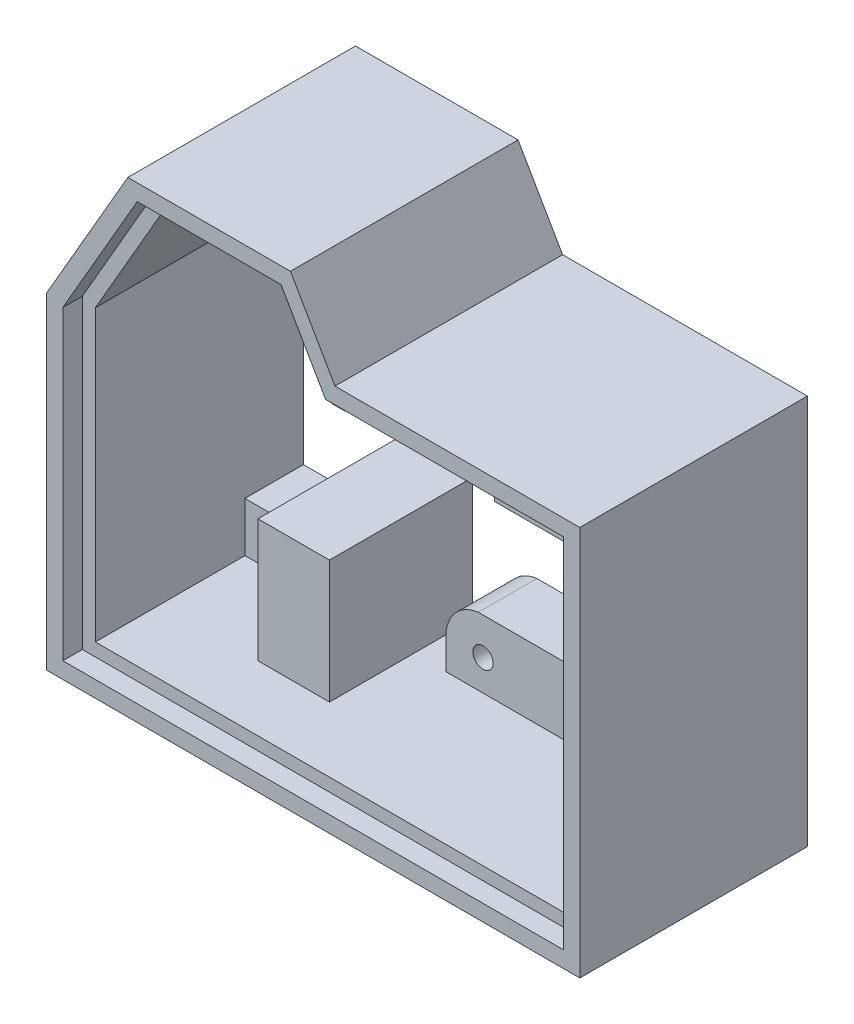
from build123d import *

# Parameters (mm, degrees)
BOSS_EXTRUDE1_DEPTH = 35
CUT_EXTRUDE1_DEPTH  = 26
SKETCH4_W           = 36.590571665
SKETCH4_H           = 16.65
BOSS_EXTRUDE2_DEPTH = 4.3
SKETCH5_W           = 22.6
SKETCH5_H           = 11.85
CUT_EXTRUDE2_DEPTH  = 4.2
CUT_EXTRUDE3_DEPTH  = 17.2
BOSS_EXTRUDE3_DEPTH = 23
SKETCH11_R          = 1.5625
CUT_EXTRUDE7_DEPTH  = 12.54
SKETCH13_R          = 1.7526
CUT_EXTRUDE8_DEPTH  = 16
SKETCH15_W          = 11
SKETCH15_H          = 18.91
BOSS_EXTRUDE4_DEPTH = 22


with BuildPart() as part:
    # Sketch1 → Boss-Extrude1 (new body)
    with BuildSketch(Plane.XY):
        Polygon((0, 50.21875), (0, 0), (82, 0), (82, 60), (44.352804008, 60), (37.500008496, 71.86939), (12.500002832, 71.86939), align=None)
    extrude(amount=BOSS_EXTRUDE1_DEPTH)

    # Sketch3 → Cut-Extrude1 (cut)
    with BuildSketch(Plane.XY.offset(35)):
        Polygon((42.909428335, 57.5), (36.056632823, 69.36939), (13.943378505, 69.36939), (2.5, 49.548877019), (2.5, 2.5), (79.5, 2.5), (79.5, 57.5), align=None)
    extrude(amount=-CUT_EXTRUDE1_DEPTH, mode=Mode.SUBTRACT)

    # Sketch4 → Boss-Extrude2 (add)
    with BuildSketch(Plane.XY.offset(9)):
        with Locations((61.204714168, 49.175)):
            Rectangle(SKETCH4_W, SKETCH4_H)
    extrude(amount=BOSS_EXTRUDE2_DEPTH)

    # Sketch5 → Cut-Extrude2 (cut)
    with BuildSketch(Plane.XY.offset(13.3)):
        with Locations((60.82763, 51.575)):
            Rectangle(SKETCH5_W, SKETCH5_H)
    extrude(amount=-CUT_EXTRUDE2_DEPTH, mode=Mode.SUBTRACT)

    # Sketch6 → Cut-Extrude3 (cut)
    with BuildSketch(Plane.XY.offset(9.1)):
        with BuildLine():
            Line((61.72763, 54.15), (60.723855071, 54.15))
            ThreePointArc((60.723855071, 54.15), (49.52763, 51.55), (60.723855071, 48.95))
            Line((60.723855071, 48.95), (61.72763, 48.95))
            ThreePointArc((61.72763, 48.95), (64.32763, 51.55), (61.72763, 54.15))
        make_face()
    extrude(amount=-CUT_EXTRUDE3_DEPTH, mode=Mode.SUBTRACT)

    # Sketch7 → Boss-Extrude3 (add)
    with BuildSketch(Plane.XY.offset(9)):
        Polygon((40.909428335, 56.964101615), (40.909428335, 54.429795973), (42.909428335, 54.429795973), (42.909428335, 57.5), (36.056632823, 69.36939), (13.943378505, 69.36939), (2.5, 49.548877019), (2.5, 2.5), (79.5, 2.5), (79.5, 40.85), (77.5, 40.85), (77.5, 4.5), (4.5, 4.5), (4.5, 49.012978634), (15.098079043, 67.36939), (34.901932285, 67.36939), align=None)
    extrude(amount=BOSS_EXTRUDE3_DEPTH)

    # Sketch11 → Cut-Extrude7 (cut)
    with BuildSketch(Plane.XY.offset(9)):
        with BuildLine():
            Line((6.14367659, 51.85991), (8.89, 51.85991))
            ThreePointArc((8.89, 51.85991), (12.1205, 48.62941), (8.89, 45.39891))
            Line((8.89, 45.39891), (4.5, 45.39891))
            Line((4.5, 45.39891), (4.5, 12.1205))
            Line((4.5, 12.1205), (8.89, 12.1205))
            ThreePointArc((8.89, 12.1205), (11.174308457, 11.174308457), (12.1205, 8.89))
            Line((12.1205, 8.89), (12.1205, 4.5))
            Line((12.1205, 4.5), (35.398460219, 4.5))
            Line((35.398460219, 4.5), (35.398460219, 9.237253753))
            ThreePointArc((35.398460219, 9.237253753), (36.826407652, 13.014445691), (40.396010976, 14.90234))
            Line((40.396010976, 14.90234), (72.25, 14.90234))
            Line((72.25, 14.90234), (72.25, 30.90234))
            Line((72.25, 30.90234), (42.909428335, 30.90234))
            Line((42.909428335, 30.90234), (42.909428335, 54.429795973))
            Line((42.909428335, 54.429795973), (40.909428335, 54.429795973))
            Line((40.909428335, 54.429795973), (40.909428335, 56.964101615))
            Line((40.909428335, 56.964101615), (34.901932285, 67.36939))
            Line((34.901932285, 67.36939), (15.098079043, 67.36939))
            Line((15.098079043, 67.36939), (6.14367659, 51.85991))
        make_face()
        with Locations((8.89, 8.89)):
            Circle(SKETCH11_R)
        with Locations((8.89, 48.62941)):
            Circle(SKETCH11_R)
        with Locations((41.108128667, 9.237253753)):
            Circle(SKETCH11_R)
    extrude(amount=-CUT_EXTRUDE7_DEPTH, mode=Mode.SUBTRACT)

    # Sketch13 → Cut-Extrude8 (cut)
    with BuildSketch(Plane.XY.offset(9)):
        with Locations((60.00821, 11)):
            Circle(SKETCH13_R)
        with Locations((60.00821, 35)):
            Circle(SKETCH13_R)
    extrude(amount=-CUT_EXTRUDE8_DEPTH, mode=Mode.SUBTRACT)

    # Sketch15 → Boss-Extrude4 (add)
    with BuildSketch(Plane(origin=(0, 0, 0), x_dir=(-1, 0, 0), z_dir=(0, 0, -1))):
        with Locations((-25, 13.955)):
            Rectangle(SKETCH15_W, SKETCH15_H)
    extrude(amount=-BOSS_EXTRUDE4_DEPTH)


solid = part.part
